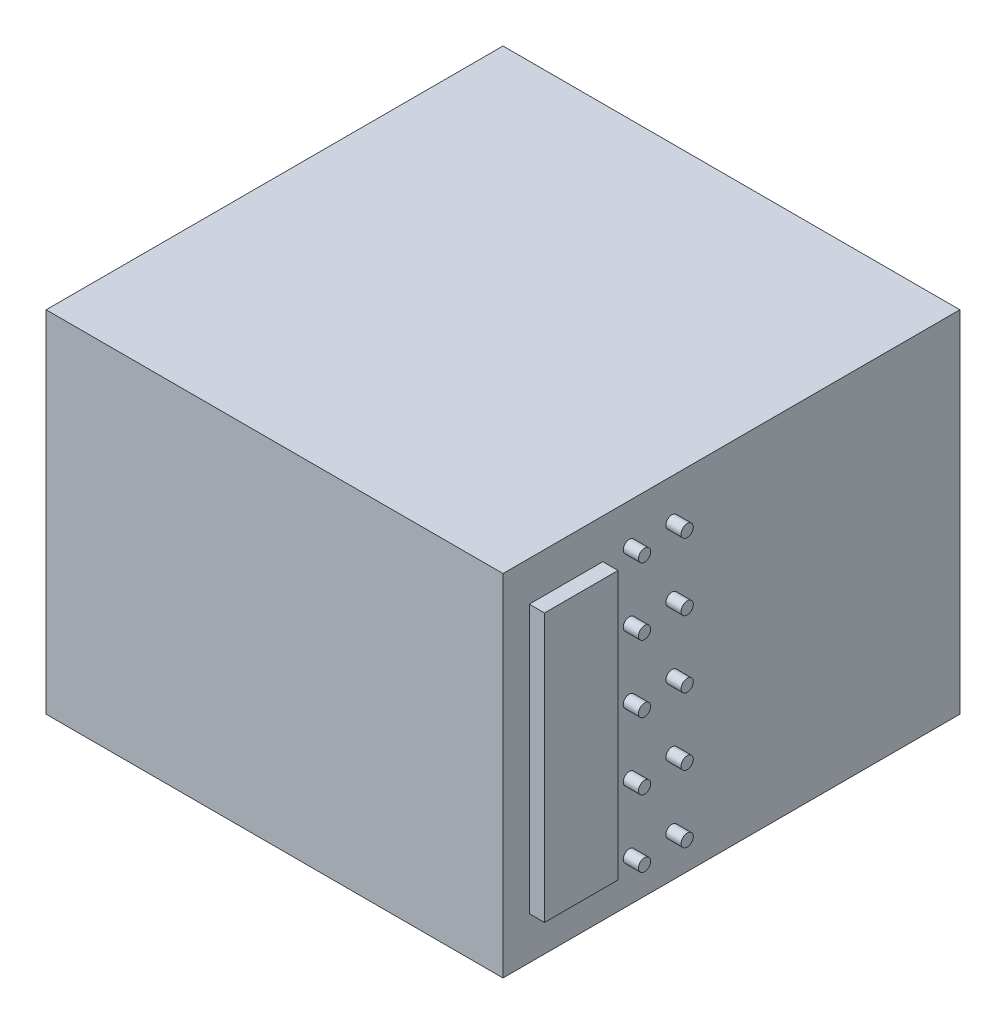
from build123d import *

# Parameters (mm, degrees)
SKETCH1_W           = 1500
SKETCH1_H           = 1150
BOSS_EXTRUDE1_DEPTH = 1500
SKETCH2_R           = 20
SKETCH2_W           = 241.410698637
SKETCH2_H           = 880
BOSS_EXTRUDE2_DEPTH = 50


with BuildPart() as part:
    # Sketch1 → Boss-Extrude1 (new body)
    with BuildSketch(Plane.XY):
        with Locations((6655.660377358, 8788.20754717)):
            Rectangle(SKETCH1_W, SKETCH1_H)
    extrude(amount=BOSS_EXTRUDE1_DEPTH)

    # Sketch2 → Boss-Extrude2 (add)
    with BuildSketch(Plane(origin=(7405.660377359, 0, 0), x_dir=(0, 0, -1), z_dir=(1, 0, 0))):
        with Locations(Location((-1085.234472632, 8353.074404115, 0), (0, 0, 270))):
            Circle(SKETCH2_R)
        with Locations(Location((-945.234472632, 8353.074404115, 0), (0, 0, 270))):
            Circle(SKETCH2_R)
        with Locations(Location((-945.234472632, 8573.074404115, 0), (0, 0, 270))):
            Circle(SKETCH2_R)
        with Locations(Location((-945.234472632, 8793.074404115, 0), (0, 0, 270))):
            Circle(SKETCH2_R)
        with Locations(Location((-945.234472632, 9013.074404115, 0), (0, 0, 270))):
            Circle(SKETCH2_R)
        with Locations(Location((-945.234472632, 9233.074404115, 0), (0, 0, 270))):
            Circle(SKETCH2_R)
        with Locations(Location((-1085.234472632, 8573.074404115, 0), (0, 0, 270))):
            Circle(SKETCH2_R)
        with Locations(Location((-1085.234472632, 8793.074404115, 0), (0, 0, 270))):
            Circle(SKETCH2_R)
        with Locations(Location((-1085.234472632, 9013.074404115, 0), (0, 0, 270))):
            Circle(SKETCH2_R)
        with Locations(Location((-1085.234472632, 9233.074404115, 0), (0, 0, 270))):
            Circle(SKETCH2_R)
        with Locations((-1293.028757662, 8793.074404115)):
            Rectangle(SKETCH2_W, SKETCH2_H)
    extrude(amount=BOSS_EXTRUDE2_DEPTH)


solid = part.part
